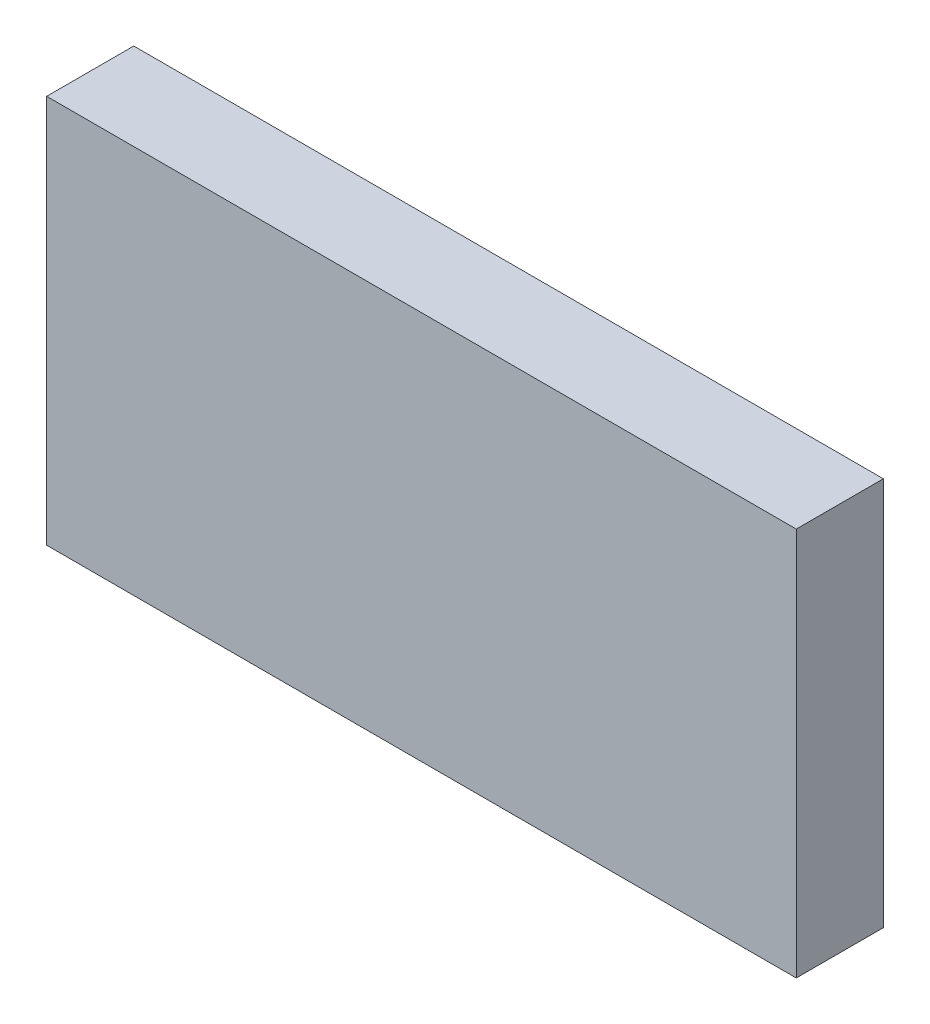
from build123d import *

# Parameters (mm, degrees)
SKETCH1_W           = 24.1
SKETCH1_H           = 2.8
BOSS_EXTRUDE1_DEPTH = 12.5


with BuildPart() as part:
    # Sketch1 → Boss-Extrude1 (new body)
    with BuildSketch(Plane(origin=(0, 0, 0), x_dir=(1, 0, 0), z_dir=(0, 1, 0))):
        with Locations((12.05, 1.4)):
            Rectangle(SKETCH1_W, SKETCH1_H)
    extrude(amount=BOSS_EXTRUDE1_DEPTH)


solid = part.part
